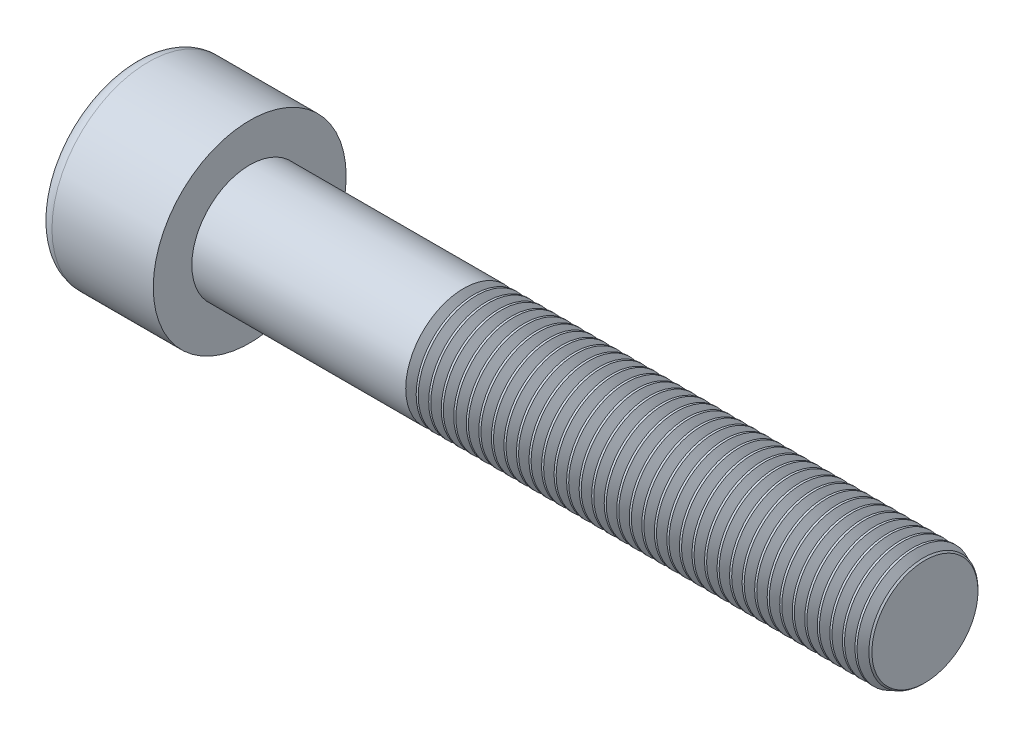
from build123d import *

# Parameters (mm, degrees)
SKETCH1_R           = 5
BASEHEAD_DEPTH      = 6
SKETCH2_R           = 3
BASEBODY_DEPTH      = 35
HEXAGONSOCKET_DEPTH = 3
TOPFILLET_R         = 0.75
CHAMFER1_SIZE       = 0.25
LPATTERN10_COUNT    = 37
LPATTERN10_PITCH    = 0.6498


with BuildPart() as part:
    # Sketch1 → BaseHead (new body)
    with BuildSketch(Plane(origin=(0, 0, 0), x_dir=(0, 0, -1), z_dir=(1, 0, 0))):
        Circle(SKETCH1_R)
    extrude(amount=BASEHEAD_DEPTH)

    # Sketch2 → BaseBody (add)
    with BuildSketch(Plane(origin=(6, 0, 0), x_dir=(0, 0, -1), z_dir=(1, 0, 0))):
        Circle(SKETCH2_R)
    extrude(amount=BASEBODY_DEPTH)

    # Sketch3 → HexagonSocket (cut)
    with BuildSketch(Plane(origin=(0, 0, 0), x_dir=(0, 0, -1), z_dir=(1, 0, 0))):
        Polygon((2.886751346, 0), (1.443375673, 2.5), (-1.443375673, 2.5), (-2.886751346, 0), (-1.443375673, -2.5), (1.443375673, -2.5), align=None)
    extrude(amount=HEXAGONSOCKET_DEPTH, mode=Mode.SUBTRACT)

    # Sketch4 → Cut-Revolve1 (revolve, cut)
    with BuildSketch(Plane(origin=(-4.19613823, 0.75, 0), x_dir=(-1, 0, 0), z_dir=(0, 0, 1)), mode=Mode.PRIVATE) as cut_revolve1_sk:
        Polygon((-7.19613823, 3.25), (-8.639513903, 0.75), (-7.19613823, 0.75), align=None)
    revolve(cut_revolve1_sk.sketch.rotate(Axis((0.838992387, 0, 0), (-1, 0, 0)), 90), axis=Axis((0.838992387, 0, 0), (-1, 0, 0)), mode=Mode.SUBTRACT)

    # TopFillet
    topfillet_edges = [part.edges().sort_by_distance(p)[0] for p in [
        (0, 0, 5),
    ]]
    fillet(topfillet_edges, radius=TOPFILLET_R)

    # Chamfer1
    chamfer1_edges = [part.edges().sort_by_distance(p)[0] for p in [
        (41, 0, 3),
    ]]
    chamfer(chamfer1_edges, length=CHAMFER1_SIZE)

    # Sketch5 → Cut-Revolve10 (revolve, cut)
    with BuildSketch(Plane.XY, mode=Mode.PRIVATE) as cut_revolve10_sk:
        Polygon((40.75, 2.531047244), (41.02075, 3), (41.02075, 3.5415), (40.47925, 3.5415), (40.47925, 3), align=None)
    cut_revolve10 = revolve(cut_revolve10_sk.sketch.rotate(Axis((0, 0, 0), (1, 0, 0)), 90), axis=Axis((0, 0, 0), (1, 0, 0)), mode=Mode.SUBTRACT)

    # LPattern10: Cut-Revolve10 ×37
    with Locations(*[(-i * LPATTERN10_PITCH, 0, 0) for i in range(1, LPATTERN10_COUNT)]):
        add(cut_revolve10, mode=Mode.SUBTRACT)


solid = part.part
